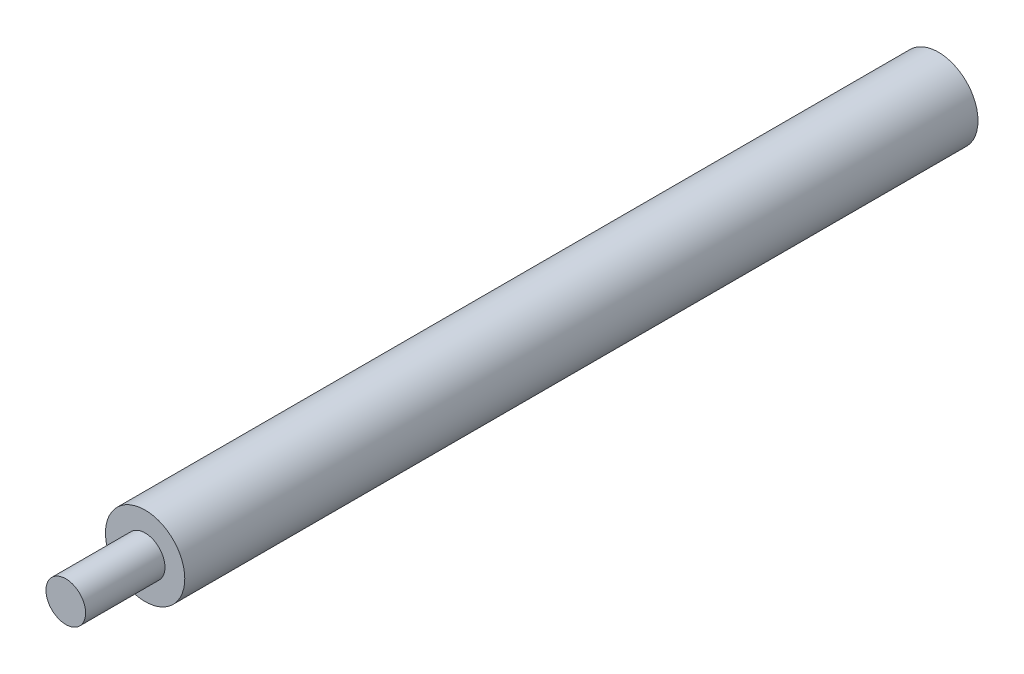
from build123d import *

# Parameters (mm, degrees)
SKETCH1_R           = 2.5
BOSS_EXTRUDE1_DEPTH = 50
SKETCH2_R           = 1.25
BOSS_EXTRUDE2_DEPTH = 5
SKETCH3_R           = 1.25
CUT_EXTRUDE1_DEPTH  = 5


with BuildPart() as part:
    # Sketch1 → Boss-Extrude1 (new body)
    with BuildSketch(Plane.XY):
        Circle(SKETCH1_R)
    extrude(amount=BOSS_EXTRUDE1_DEPTH)

    # Sketch2 → Boss-Extrude2 (add)
    with BuildSketch(Plane.XY.offset(50)):
        Circle(SKETCH2_R)
    extrude(amount=BOSS_EXTRUDE2_DEPTH)

    # Sketch3 → Cut-Extrude1 (cut)
    with BuildSketch(Plane(origin=(0, 0, 0), x_dir=(-1, 0, 0), z_dir=(0, 0, -1))):
        with Locations(Location((0, 0, 0), (0, 0, 180))):
            Circle(SKETCH3_R)
    extrude(amount=-CUT_EXTRUDE1_DEPTH, mode=Mode.SUBTRACT)


solid = part.part
